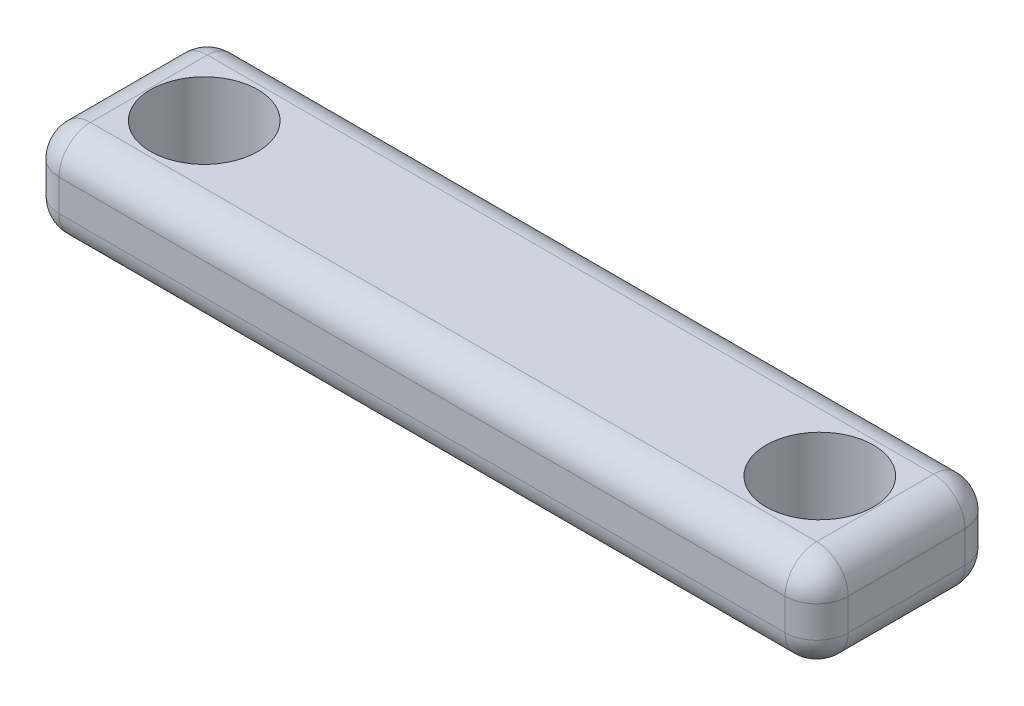
from build123d import *

# Parameters (mm, degrees)
SKETCH1_W           = 25
SKETCH1_H           = 5.7
SKETCH1_R           = 1.7
BOSS_EXTRUDE1_DEPTH = 3
FILLET1_R           = 1


with BuildPart() as part:
    # Sketch1 → Boss-Extrude1 (new body)
    with BuildSketch(Plane(origin=(0, 0, 0), x_dir=(1, 0, 0), z_dir=(0, 1, 0))):
        with Locations((12.5, 2.85)):
            Rectangle(SKETCH1_W, SKETCH1_H)
        with Locations(Location((2.75, 2.85, 0), (0, 0, 270))):
            Circle(SKETCH1_R, mode=Mode.SUBTRACT)
        with Locations(Location((22.25, 2.85, 0), (0, 0, 270))):
            Circle(SKETCH1_R, mode=Mode.SUBTRACT)
    extrude(amount=BOSS_EXTRUDE1_DEPTH)

    # Fillet1
    fillet1_edges = [part.edges().sort_by_distance(p)[0] for p in [
        (25, 3, -2.85),
        (12.5, 3, -5.7),
        (0, 3, -2.85),
        (12.5, 0, -5.7),
        (25, 0, -2.85),
        (12.5, 0, 0),
        (0, 0, -2.85),
        (0, 1.5, -5.7),
        (25, 1.5, -5.7),
        (25, 1.5, 0),
        (0, 1.5, 0),
        (12.5, 3, 0),
    ]]
    fillet(fillet1_edges, radius=FILLET1_R)


solid = part.part
